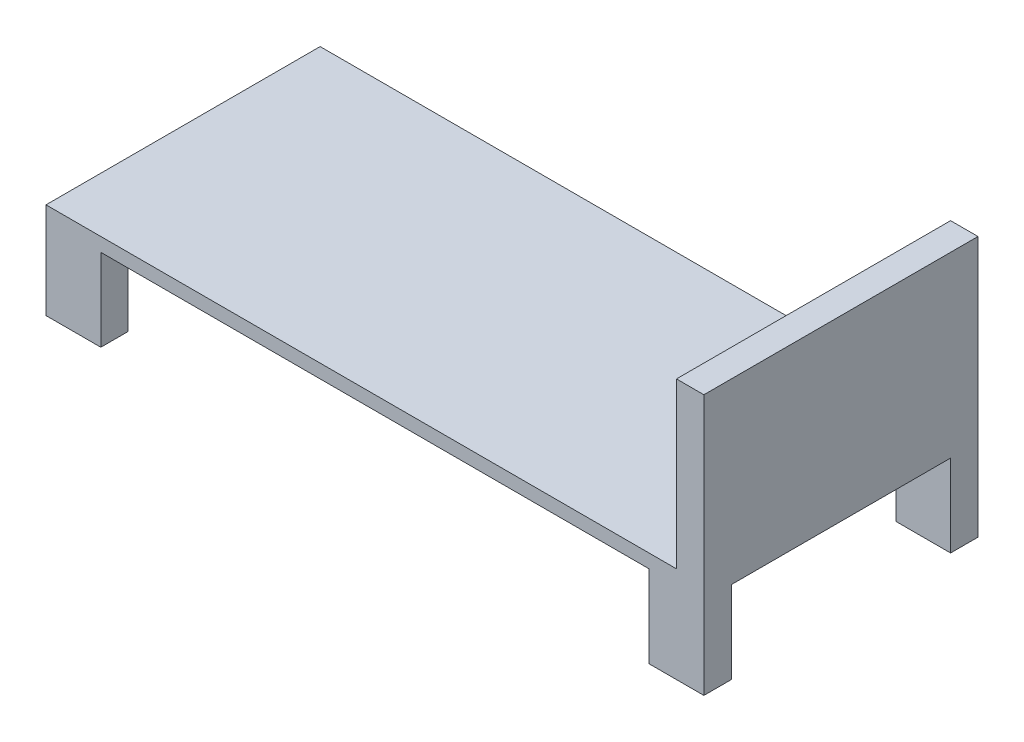
from build123d import *

# Parameters (mm, degrees)
SKETCH1_W           = 1219.2
SKETCH1_H           = 508
BOSS_EXTRUDE1_DEPTH = 25.4
SKETCH2_W           = 50.8
SKETCH2_H           = 508
BOSS_EXTRUDE2_DEPTH = 304.8
SKETCH3_W           = 101.6
SKETCH3_H           = 50.8
BOSS_EXTRUDE3_DEPTH = 152.4


with BuildPart() as part:
    # Sketch1 → Boss-Extrude1 (new body)
    with BuildSketch(Plane(origin=(0, 0, 0), x_dir=(1, 0, 0), z_dir=(0, 1, 0))):
        with Locations((609.6, 254)):
            Rectangle(SKETCH1_W, SKETCH1_H)
    extrude(amount=BOSS_EXTRUDE1_DEPTH)

    # Sketch2 → Boss-Extrude2 (add)
    with BuildSketch(Plane(origin=(0, 25.4, 0), x_dir=(1, 0, 0), z_dir=(0, 1, 0))):
        with Locations((1193.8, 254)):
            Rectangle(SKETCH2_W, SKETCH2_H)
    extrude(amount=BOSS_EXTRUDE2_DEPTH)

    # Sketch3 → Boss-Extrude3 (add)
    with BuildSketch(Plane.XZ):
        with Locations((50.8, -25.4)):
            Rectangle(SKETCH3_W, SKETCH3_H)
        with Locations((50.8, -482.6)):
            Rectangle(SKETCH3_W, SKETCH3_H)
        with Locations((1168.4, -25.4)):
            Rectangle(SKETCH3_W, SKETCH3_H)
        with Locations((1168.4, -482.6)):
            Rectangle(SKETCH3_W, SKETCH3_H)
    extrude(amount=BOSS_EXTRUDE3_DEPTH)


solid = part.part
